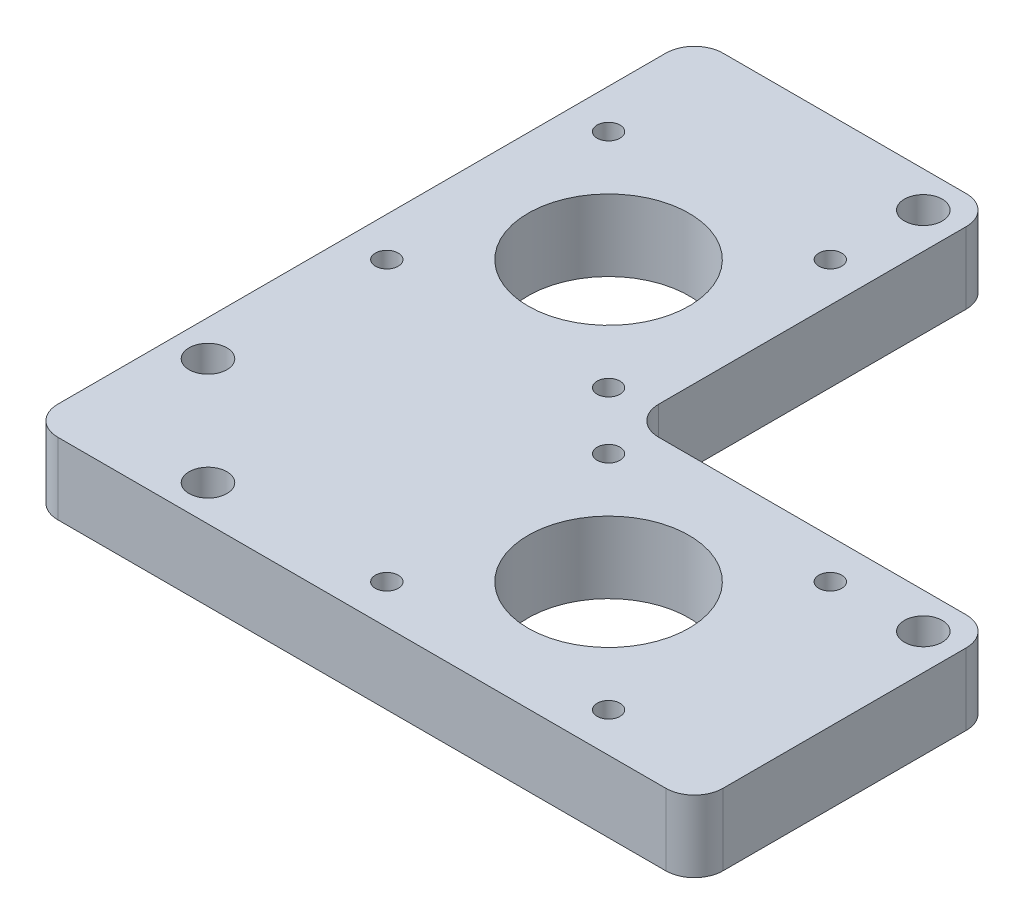
from build123d import *

# Parameters (mm, degrees)
BOSS_EXTRUDE1_DEPTH            = 10
F_22_5_22_5_DIAMETER_HOLE1_D   = 22.5
CBORE_FOR_M3_SHCS1_D           = 3.2
CBORE_FOR_M3_SHCS1_CBORE_D     = 6.5
CBORE_FOR_M3_SHCS1_CBORE_DEPTH = 3
BOSS_EXTRUDE2_DEPTH            = 10
SKETCH17_W                     = 12
SKETCH17_H                     = 42
BOSS_EXTRUDE3_DEPTH            = 10
M5_CLEARANCE_HOLE1_D           = 5.3
SKETCH20_W                     = 38.1
SKETCH20_H                     = 38.1
BOSS_EXTRUDE4_DEPTH            = 10
M5_CLEARANCE_HOLE2_D           = 5.3
FILLET6_R                      = 4


with BuildPart() as part:
    # Sketch1 → Boss-Extrude1 (new body)
    with BuildSketch(Plane(origin=(0, 0, 0), x_dir=(1, 0, 0), z_dir=(0, 1, 0))):
        Polygon((60, -21), (60, 21), (21, 21), (21, 60), (-21, 60), (-21, 18), (18, 18), (18, -21), align=None)
    extrude(amount=BOSS_EXTRUDE1_DEPTH)

    # Ø22.5 (22.5) Diameter Hole1 (through all)
    with Locations(Plane(origin=(0, 10, 0), x_dir=(1, 0, 0), z_dir=(0, 1, 0))):
        with Locations((0, 39), (39, 0)):
            Hole(F_22_5_22_5_DIAMETER_HOLE1_D / 2)

    # CBORE for M3 SHCS1 (through all)
    with Locations(Plane(origin=(0, 0, 0), x_dir=(-1, 0, 0), z_dir=(0, -1, 0))):
        with Locations((-54.5, 15.5), (-23.5, 15.5), (-23.5, -15.5), (-54.5, -15.5), (-15.5, 54.5), (-15.5, 23.5), (15.5, 23.5), (15.5, 54.5)):
            CounterBoreHole(CBORE_FOR_M3_SHCS1_D / 2, CBORE_FOR_M3_SHCS1_CBORE_D / 2, CBORE_FOR_M3_SHCS1_CBORE_DEPTH)

    # Sketch16 → Boss-Extrude2 (add)
    with BuildSketch(Plane(origin=(0, 10, 0), x_dir=(1, 0, 0), z_dir=(0, 1, 0))):
        Polygon((17.1, 17.1), (-21, 17.1), (-21, 18), (18, 18), (18, -21), (17.1, -21), align=None)
    extrude(amount=-BOSS_EXTRUDE2_DEPTH)

    # Sketch17 → Boss-Extrude3 (add)
    with BuildSketch(Plane(origin=(0, 10, 0), x_dir=(1, 0, 0), z_dir=(0, 1, 0))):
        with Locations((66, 0)):
            Rectangle(SKETCH17_W, SKETCH17_H)
    boss_extrude3 = extrude(amount=-BOSS_EXTRUDE3_DEPTH)

    # M5 Clearance Hole1 (through all)
    with Locations(Plane(origin=(0, 10, 0), x_dir=(1, 0, 0), z_dir=(0, 1, 0))):
        with Locations((67, 16)):
            m5_clearance_hole1 = Hole(M5_CLEARANCE_HOLE1_D / 2)

    # Mirror1: Boss-Extrude3, M5 Clearance Hole1 across plane
    add(boss_extrude3.mirror(Plane(origin=(0, 0, 0), x_dir=(-0.7071067811865477, 0, 0.7071067811865474), z_dir=(0.7071067811865476, 0, 0.7071067811865476))))
    add(m5_clearance_hole1.mirror(Plane(origin=(0, 0, 0), x_dir=(-0.7071067811865477, 0, 0.7071067811865474), z_dir=(0.7071067811865476, 0, 0.7071067811865476))), mode=Mode.SUBTRACT)

    # Sketch20 → Boss-Extrude4 (add)
    with BuildSketch(Plane(origin=(0, 10, 0), x_dir=(1, 0, 0), z_dir=(0, 1, 0))):
        with Locations((-1.95, -1.95)):
            Rectangle(SKETCH20_W, SKETCH20_H)
    extrude(amount=-BOSS_EXTRUDE4_DEPTH)

    # M5 Clearance Hole2 (through all)
    with Locations(Plane(origin=(0, 10, 0), x_dir=(1, 0, 0), z_dir=(0, 1, 0))):
        with Locations((-16, -1), (-1, -16)):
            Hole(M5_CLEARANCE_HOLE2_D / 2)

    # Fillet6
    fillet6_edges = [part.edges().sort_by_distance(p)[0] for p in [
        (72, 5, -21),
        (72, 5, 21),
        (21, 5, -72),
        (-21, 5, -72),
        (21, 5, -21),
        (-21, 5, 21),
    ]]
    fillet(fillet6_edges, radius=FILLET6_R)


solid = part.part
